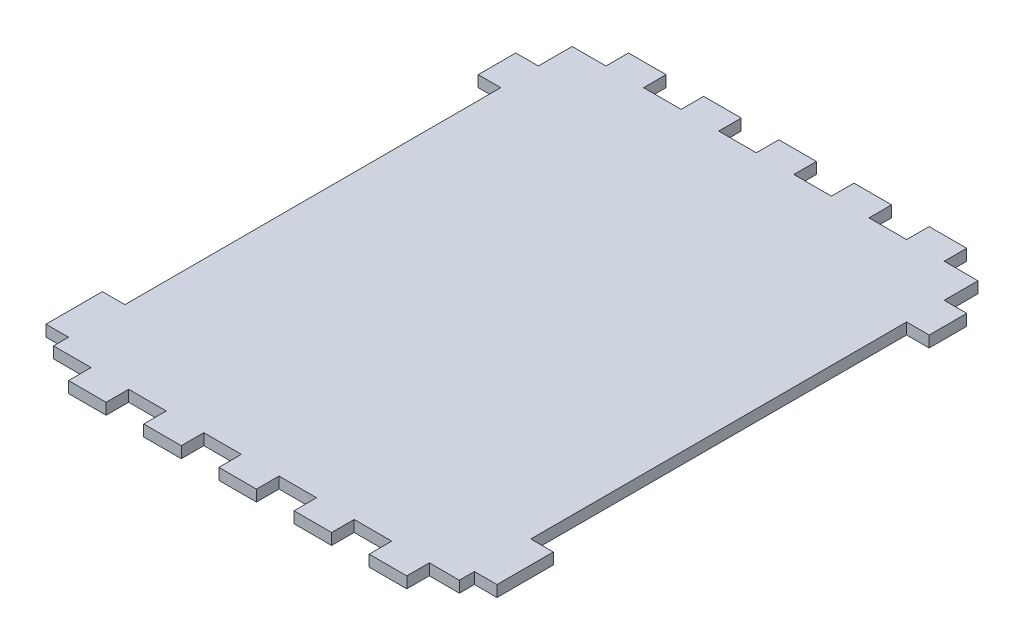
from build123d import *

# Parameters (mm, degrees)
SKETCH_1_W          = 108
SKETCH_1_H          = 138
EXTRUDE_1_DEPTH     = 4
SKETCH_3_W          = 108
SKETCH_3_H          = 138
CUT_EXTRUDE_2_DEPTH = 1
SKETCH_4_W          = 10
SKETCH_4_H          = 3
EXTRUDE_2_DEPTH     = 6
SKETCH_5_W          = 10
SKETCH_5_H          = 3
SKETCH_5_W_2        = 15
EXTRUDE_3_DEPTH     = 6
SKETCH_6_W          = 15
SKETCH_6_H          = 3
SKETCH_6_W_2        = 10
EXTRUDE_4_DEPTH     = 6
SKETCH_7_W          = 10
SKETCH_7_H          = 3
EXTRUDE_5_DEPTH     = 6


with BuildPart() as part:
    # Эскиз1 → Бобышка-Вытянуть1 (new body)
    with BuildSketch(Plane(origin=(0, 0, 0), x_dir=(1, 0, 0), z_dir=(0, 1, 0))):
        with Locations((54, -69)):
            Rectangle(SKETCH_1_W, SKETCH_1_H)
    extrude(amount=EXTRUDE_1_DEPTH)

    # Эскиз3 → Вырез-Вытянуть2 (cut)
    with BuildSketch(Plane.XZ):
        with Locations((54, 69)):
            Rectangle(SKETCH_3_W, SKETCH_3_H)
    extrude(amount=-CUT_EXTRUDE_2_DEPTH, mode=Mode.SUBTRACT)

    # Эскиз4 → Бобышка-Вытянуть2 (add)
    with BuildSketch(Plane.XY.offset(138)):
        with Locations((15, 2.5)):
            Rectangle(SKETCH_4_W, SKETCH_4_H)
        with Locations((35, 2.5)):
            Rectangle(SKETCH_4_W, SKETCH_4_H)
        with Locations((55, 2.5)):
            Rectangle(SKETCH_4_W, SKETCH_4_H)
        with Locations((75, 2.5)):
            Rectangle(SKETCH_4_W, SKETCH_4_H)
        with Locations((95, 2.5)):
            Rectangle(SKETCH_4_W, SKETCH_4_H)
    extrude(amount=EXTRUDE_2_DEPTH)

    # Эскиз5 → Бобышка-Вытянуть3 (add)
    with BuildSketch(Plane.ZY):
        with Locations((14, 2.5)):
            Rectangle(SKETCH_5_W, SKETCH_5_H)
        with Locations((126.5, 2.5)):
            Rectangle(SKETCH_5_W_2, SKETCH_5_H)
    extrude(amount=EXTRUDE_3_DEPTH)

    # Эскиз6 → Бобышка-Вытянуть4 (add)
    with BuildSketch(Plane(origin=(108, 0, 0), x_dir=(0, 0, -1), z_dir=(1, 0, 0))):
        with Locations((-126.5, 2.5)):
            Rectangle(SKETCH_6_W, SKETCH_6_H)
        with Locations((-14, 2.5)):
            Rectangle(SKETCH_6_W_2, SKETCH_6_H)
    extrude(amount=EXTRUDE_4_DEPTH)

    # Эскиз7 → Бобышка-Вытянуть5 (add)
    with BuildSketch(Plane(origin=(0, 0, 0), x_dir=(-1, 0, 0), z_dir=(0, 0, -1))):
        with Locations((-94, 2.5)):
            Rectangle(SKETCH_7_W, SKETCH_7_H)
        with Locations((-74, 2.5)):
            Rectangle(SKETCH_7_W, SKETCH_7_H)
        with Locations((-54, 2.5)):
            Rectangle(SKETCH_7_W, SKETCH_7_H)
        with Locations((-34, 2.5)):
            Rectangle(SKETCH_7_W, SKETCH_7_H)
        with Locations((-14, 2.5)):
            Rectangle(SKETCH_7_W, SKETCH_7_H)
    extrude(amount=EXTRUDE_5_DEPTH)


solid = part.part
